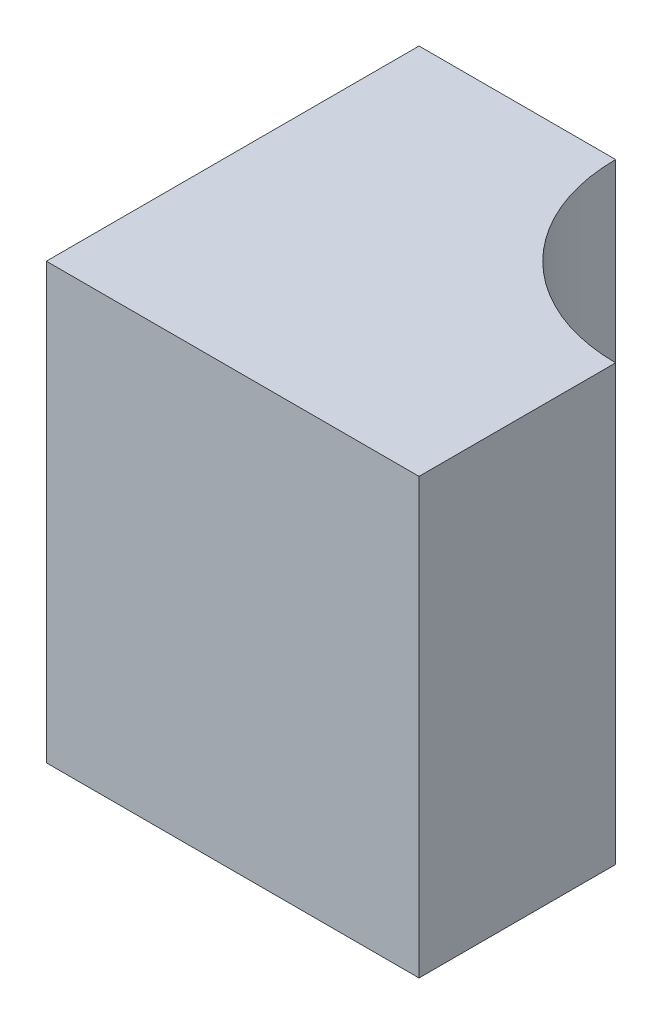
from build123d import *

# Parameters (mm, degrees)
BOSS_EXTRUDE1_DEPTH = 19


with BuildPart() as part:
    # Sketch1 → Boss-Extrude1 (new body)
    with BuildSketch(Plane(origin=(0, 0, 0), x_dir=(1, 0, 0), z_dir=(0, 1, 0))):
        with BuildLine():
            Line((8.8, 16.5), (0.2, 16.5))
            Line((0.2, 16.5), (0.2, 0.2))
            Line((0.2, 0.2), (16.5, 0.2))
            Line((16.5, 0.2), (16.5, 8.8))
            ThreePointArc((16.5, 8.8), (11.055277785, 11.055277785), (8.8, 16.5))
        make_face()
    extrude(amount=BOSS_EXTRUDE1_DEPTH)


solid = part.part
